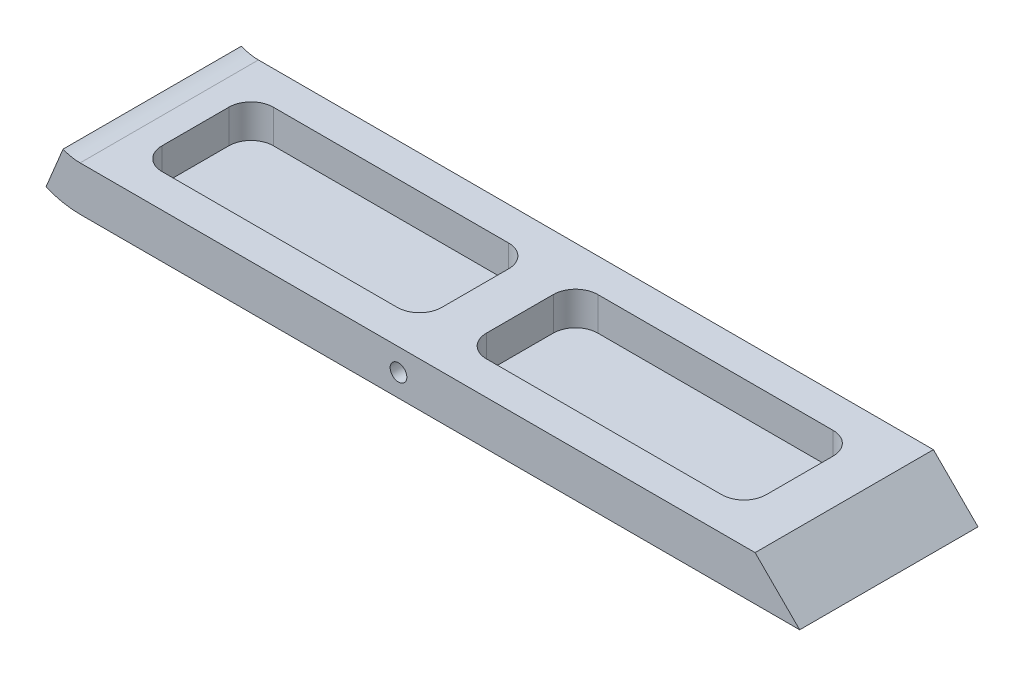
from build123d import *

# Parameters (mm, degrees)
EXTRUDE1_DEPTH     = 50.8
CUT_EXTRUDE1_DEPTH = 9.525
SKETCH3_R          = 2.38125
CUT_EXTRUDE2_DEPTH = 15.875
CUT_EXTRUDE3_START = -15.875
SKETCH4_R          = 2.38125
CUT_EXTRUDE3_DEPTH = 15.875
CUT_EXTRUDE4_DEPTH = 222.795964766
EXTRUDE2_DEPTH     = 50.8


with BuildPart() as part:
    # Sketch1 → Extrude1 (new body)
    with BuildSketch(Plane.XY):
        Polygon((0, 0), (215.526146874, 0), (202.826146874, 12.7), (5.260512242, 12.7), align=None)
    extrude(amount=EXTRUDE1_DEPTH)

    # Sketch2 → Cut-Extrude1 (cut)
    with BuildSketch(Plane(origin=(0, 12.7, 0), x_dir=(-1, 0, 0), z_dir=(0, 1, 0))):
        with BuildLine():
            Line((-183.776146874, 41.275), (-116.743329558, 41.275))
            ThreePointArc((-116.743329558, 41.275), (-112.253201498, 39.415128061), (-110.393329558, 34.925))
            Line((-110.393329558, 34.925), (-110.393329558, 15.875))
            ThreePointArc((-110.393329558, 15.875), (-112.253201498, 11.384871939), (-116.743329558, 9.525))
            Line((-116.743329558, 9.525), (-183.776146874, 9.525))
            ThreePointArc((-183.776146874, 9.525), (-188.266274935, 11.384871939), (-190.126146874, 15.875))
            Line((-190.126146874, 15.875), (-190.126146874, 34.925))
            ThreePointArc((-190.126146874, 34.925), (-188.266274935, 39.415128061), (-183.776146874, 41.275))
        make_face()
        with BuildLine():
            Line((-91.343329558, 9.525), (-24.310512242, 9.525))
            ThreePointArc((-24.310512242, 9.525), (-19.820384182, 11.384871939), (-17.960512242, 15.875))
            Line((-17.960512242, 15.875), (-17.960512242, 34.925))
            ThreePointArc((-17.960512242, 34.925), (-19.820384182, 39.415128061), (-24.310512242, 41.275))
            Line((-24.310512242, 41.275), (-91.343329558, 41.275))
            ThreePointArc((-91.343329558, 41.275), (-95.833457619, 39.415128061), (-97.693329558, 34.925))
            Line((-97.693329558, 34.925), (-97.693329558, 15.875))
            ThreePointArc((-97.693329558, 15.875), (-95.833457619, 11.384871939), (-91.343329558, 9.525))
        make_face()
    extrude(amount=-CUT_EXTRUDE1_DEPTH, mode=Mode.SUBTRACT)

    # Sketch3 → Cut-Extrude2 (cut)
    with BuildSketch(Plane.XY.offset(50.8)):
        with Locations((101.226146874, 6.35)):
            Circle(SKETCH3_R)
    extrude(amount=-CUT_EXTRUDE2_DEPTH, mode=Mode.SUBTRACT)

    # Sketch4 → Cut-Extrude3 (cut)
    with BuildSketch(Plane(origin=(0, 0, 0), x_dir=(-1, 0, 0), z_dir=(0, 0, -1)).offset(CUT_EXTRUDE3_START)):
        with Locations(Location((-101.226146874, 6.35, 0), (0, 0, 180))):
            Circle(SKETCH4_R)
    extrude(amount=CUT_EXTRUDE3_DEPTH, mode=Mode.SUBTRACT)

    # Sketch5 → Cut-Extrude4 (cut, through all)
    with BuildSketch(Plane.XY.offset(50.8)):
        with BuildLine():
            Line((0.800865302, 1.933459874), (0, 0))
            Line((0, 0), (10.521024484, 0))
            ThreePointArc((10.521024484, 0), (5.565730305, 0.488053878), (0.800865302, 1.933459874))
        make_face()
    extrude(amount=-CUT_EXTRUDE4_DEPTH, mode=Mode.SUBTRACT)

    # Sketch6 → Extrude2 (add)
    with BuildSketch(Plane.XY.offset(50.8)):
        with BuildLine():
            Line((5.660944893, 13.666729937), (5.260512242, 12.7))
            Line((5.260512242, 12.7), (10.521024484, 12.7))
            ThreePointArc((10.521024484, 12.7), (8.043377395, 12.944026939), (5.660944893, 13.666729937))
        make_face()
    extrude(amount=-EXTRUDE2_DEPTH)


solid = part.part
